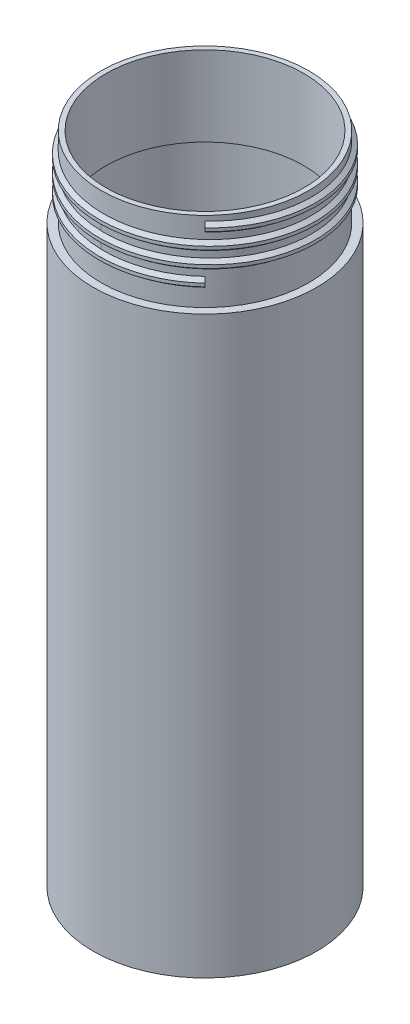
from build123d import *

# Parameters (mm, degrees)
SKETCH1_R           = 35
BOSS_EXTRUDE1_DEPTH = 180
SKETCH8_R           = 32.5
CUT_EXTRUDE2_DEPTH  = 164
SKETCH9_R           = 33
CUT_EXTRUDE3_DEPTH  = 15
SWEEP2_PITCH        = 3
SWEEP2_HEIGHT       = 9
SWEEP2_RADIUS       = 33
SWEEP2_START_ANGLE  = 45
SKETCH21_R          = 32.5
BOSS_EXTRUDE3_DEPTH = 25
SKETCH22_R          = 31
CUT_EXTRUDE4_DEPTH  = 103
SWEEP3_PITCH        = 5
SWEEP3_HEIGHT       = 15
SWEEP3_RADIUS       = 32.5
SWEEP3_START_ANGLE  = 45
CUT_EXTRUDE5_DEPTH  = 1
CUT_EXTRUDE6_DEPTH  = 186.717527541
CUT_EXTRUDE7_START  = -1
CUT_EXTRUDE7_DEPTH  = 1


with BuildPart() as part:
    # Sketch1 → Boss-Extrude1 (new body)
    with BuildSketch(Plane(origin=(0, 0, 0), x_dir=(1, 0, 0), z_dir=(0, 1, 0))):
        with Locations(Location((0, 0, 0), (0, 0, 90))):
            Circle(SKETCH1_R)
    extrude(amount=BOSS_EXTRUDE1_DEPTH)

    # Sketch8 → Cut-Extrude2 (cut)
    with BuildSketch(Plane(origin=(0, 180, 0), x_dir=(1, 0, 0), z_dir=(0, 1, 0))):
        with Locations(Location((0, 0, 0), (0, 0, 270))):
            Circle(SKETCH8_R)
    extrude(amount=-CUT_EXTRUDE2_DEPTH, mode=Mode.SUBTRACT)

    # Sketch9 → Cut-Extrude3 (cut)
    with BuildSketch(Plane(origin=(0, 0, 0), x_dir=(-1, 0, 0), z_dir=(0, -1, 0))):
        with Locations(Location((0, 0, 0), (0, 0, 90))):
            Circle(SKETCH9_R)
    extrude(amount=-CUT_EXTRUDE3_DEPTH, mode=Mode.SUBTRACT)

    # Sweep2: sweep along a helix
    with BuildLine() as sweep2_path:
        add(Helix(SWEEP2_PITCH, SWEEP2_HEIGHT, SWEEP2_RADIUS, center=(0, 12, 0), direction=(0, -1, 0), lefthand=True, mode=Mode.PRIVATE).rotate(Axis((0, 12, 0), (0, -1, 0)), SWEEP2_START_ANGLE))
    # Sketch20 → Sweep2 (sweep)
    with BuildSketch(Plane(origin=(23.334523779, 3, -23.334523779), x_dir=(-0.7068848147906569, -0.014464089372720333, 0.7071807751466358), z_dir=(-0.7070327794827355, -0.014467116986958826, -0.7070327794826795))):
        Polygon((-0.3, 1), (-0.3, -1), (0.7, -0.25), (0.7, 0.25), align=None)
    sweep(path=sweep2_path.line, is_frenet=True)

    # Sketch25 → Cut-Extrude5 (cut)
    with BuildSketch(Plane(origin=(0, 180, 0), x_dir=(1, 0, 0), z_dir=(0, 1, 0))):
        with BuildLine():
            Line((-34.054322657, 0.986696038), (-33.984093808, -2.454517559))
            ThreePointArc((-33.984093808, -2.454517559), (-34.285124711, -2.768091416), (-34.598698568, -2.467060513))
            Line((-34.598698568, -2.467060513), (-34.668927417, 0.974153083))
            ThreePointArc((-34.668927417, 0.974153083), (-34.367896514, 1.28772694), (-34.054322657, 0.986696038))
        make_face()
    extrude(amount=-CUT_EXTRUDE5_DEPTH, mode=Mode.SUBTRACT)

    # Sketch26 → Cut-Extrude6 (cut, through all)
    with BuildSketch(Plane(origin=(0, 179, 0), x_dir=(1, 0, 0), z_dir=(0, 1, 0))):
        with BuildLine():
            Line((-34.157194361, -0.081232841), (-34.130445588, -1.391922713))
            ThreePointArc((-34.130445588, -1.391922713), (-34.309405369, -1.578339152), (-34.495821808, -1.39937937))
            Line((-34.495821808, -1.39937937), (-34.522570581, -0.088689498))
            ThreePointArc((-34.522570581, -0.088689498), (-34.3436108, 0.09772694), (-34.157194361, -0.081232841))
        make_face()
    extrude(amount=-CUT_EXTRUDE6_DEPTH, mode=Mode.SUBTRACT)

    # Sketch30 → Cut-Extrude7 (cut)
    with BuildSketch(Plane(origin=(0, 0, 0), x_dir=(-1, 0, 0), z_dir=(0, -1, 0)).offset(CUT_EXTRUDE7_START)):
        with BuildLine():
            Line((33.984093808, -2.454517559), (34.054322657, 0.986696038))
            ThreePointArc((34.054322657, 0.986696038), (34.367896514, 1.28772694), (34.668927417, 0.974153083))
            Line((34.668927417, 0.974153083), (34.598698568, -2.467060513))
            ThreePointArc((34.598698568, -2.467060513), (34.285124711, -2.768091416), (33.984093808, -2.454517559))
        make_face()
    extrude(amount=CUT_EXTRUDE7_DEPTH, mode=Mode.SUBTRACT)


with BuildPart() as body_2:
    # Sketch21 → Boss-Extrude3 (new body)
    with BuildSketch(Plane(origin=(0, 180, 0), x_dir=(1, 0, 0), z_dir=(0, 1, 0))):
        with Locations(Location((0, 0, 0), (0, 0, 270))):
            Circle(SKETCH21_R)
    extrude(amount=BOSS_EXTRUDE3_DEPTH)

    # Sketch22 → Cut-Extrude4 (cut)
    with BuildSketch(Plane(origin=(0, 205, 0), x_dir=(1, 0, 0), z_dir=(0, 1, 0))):
        with Locations(Location((0, 0, 0), (0, 0, 270))):
            Circle(SKETCH22_R)
    extrude(amount=-CUT_EXTRUDE4_DEPTH, mode=Mode.SUBTRACT)

    # Sweep3: sweep along a helix
    with BuildLine() as sweep3_path:
        add(Helix(SWEEP3_PITCH, SWEEP3_HEIGHT, SWEEP3_RADIUS, center=(0, 187, 0), direction=(0, 1, 0), lefthand=True, mode=Mode.PRIVATE).rotate(Axis((0, 187, 0), (0, 1, 0)), SWEEP3_START_ANGLE))
    # Sketch24 → Sweep3 (sweep)
    with BuildSketch(Plane(origin=(22.980970389, 187, 22.980970389), x_dir=(0.7073185410743743, 0.02409315368926567, 0.7064842541753669), z_dir=(-0.7068949093020065, 0.02447803925588795, 0.7068949093020089))):
        Polygon((-0.7, 2), (-0.7, -2), (1.3, -0.5), (1.3, 0.5), align=None)
    sweep(path=sweep3_path.line, is_frenet=True)


solid = Compound([part.part, body_2.part])
